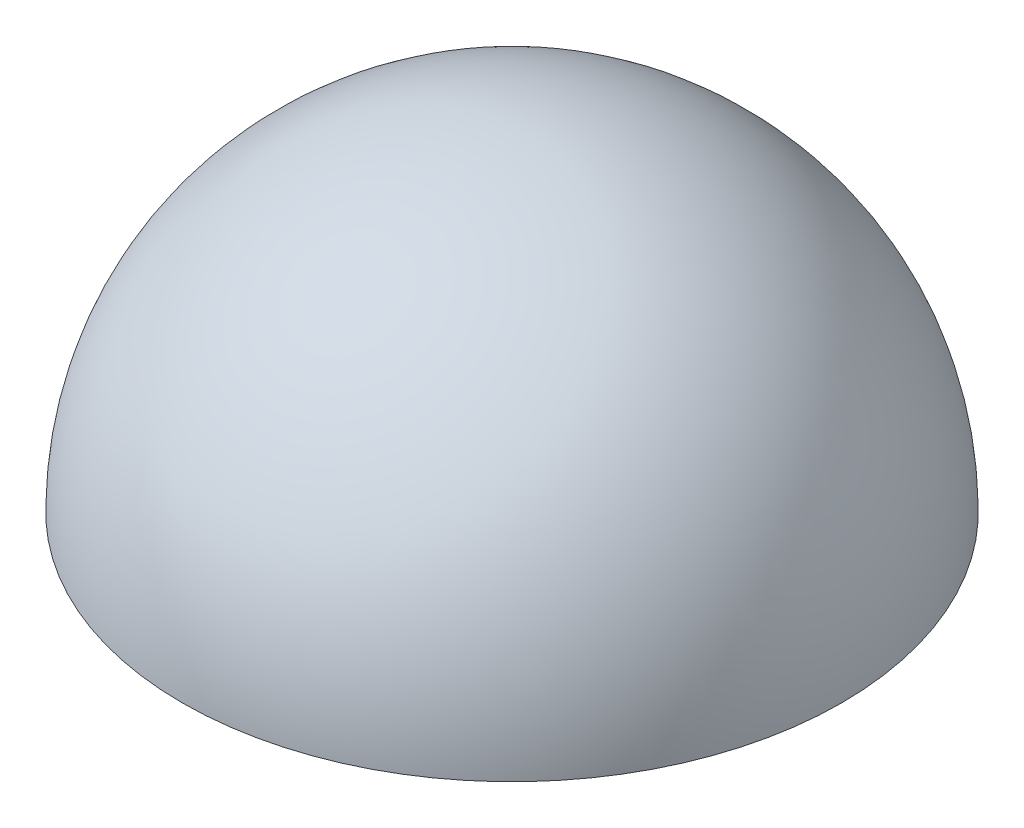
from build123d import *


with BuildPart() as part:
    # Sketch1 → Revolve1 (revolve)
    with BuildSketch(Plane.XY):
        with BuildLine():
            Line((0, 29), (0, 25))
            ThreePointArc((0, 25), (17.67766953, 17.67766953), (25, 0))
            Line((25, 0), (29, 0))
            ThreePointArc((29, 0), (20.506096654, 20.506096654), (0, 29))
        make_face()
    revolve(axis=Axis((0, 29.462489614, 0), (0, -1, 0)))


solid = part.part
